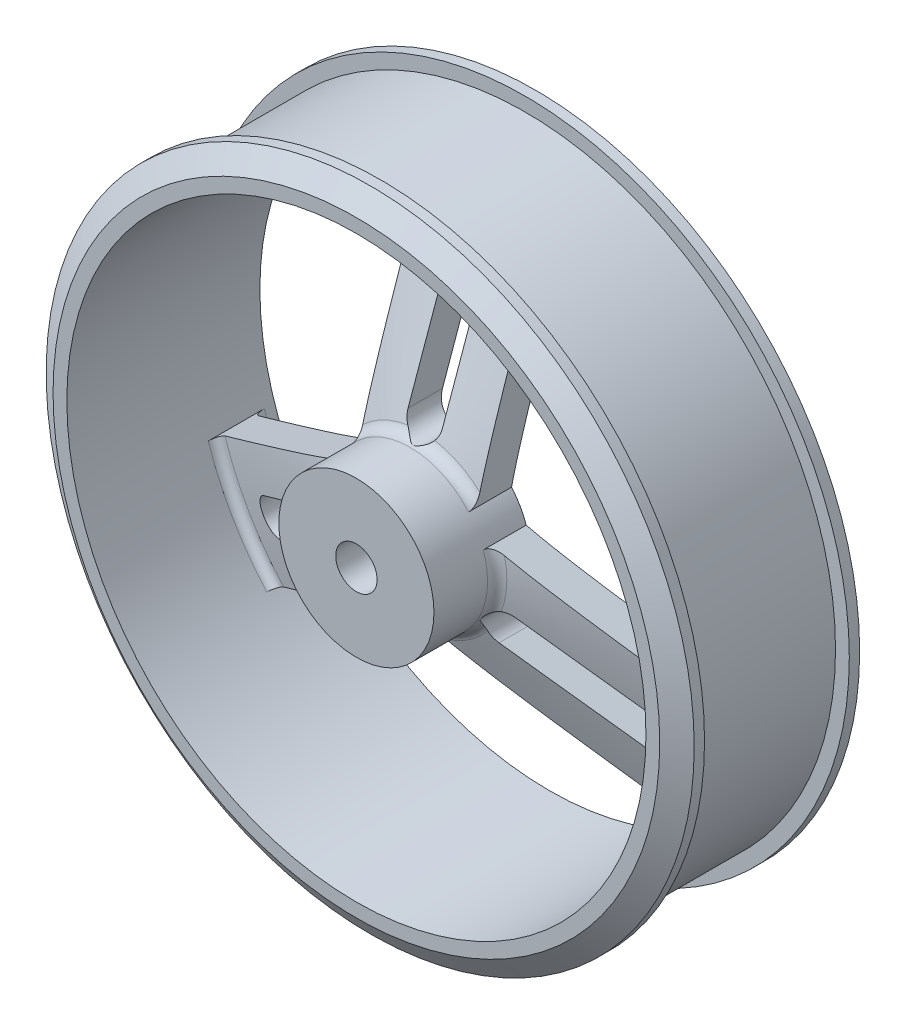
from build123d import *

# Parameters (mm, degrees)
CUT_EXTRUDE2_DEPTH      = 68.92643079096679
CUT_EXTRUDE2_DEPTH_BACK = 68.92643079096679


with BuildPart() as part:
    # Sketch1 → Revolve2 (revolve)
    with BuildSketch(Plane(origin=(0, 0, 0), x_dir=(1, 0, 0), z_dir=(0, 1, 0)), mode=Mode.PRIVATE) as revolve2_sk:
        with BuildLine():
            Line((-11.174557457948195, 1.388e-14), (-3.0000000000000044, 1.388e-14))
            Line((-3.0000000000000044, 1.388e-14), (-3.0000000000000044, -13.999999999999986))
            Line((-3.0000000000000044, -13.999999999999986), (-11.250000000000004, -13.999999999999986))
            Line((-11.250000000000004, -13.999999999999986), (-11.250000000000004, -6.226424863094397))
            ThreePointArc((-11.250000000000004, -6.226424863094397), (-11.567667832872525, -5.223744234512808), (-12.404763136484851, -4.586913999956628))
            Line((-12.404763136484851, -4.586913999956628), (-40.47025526751075, 5.452774242036372))
            ThreePointArc((-40.47025526751075, 5.452774242036372), (-41.51462498975523, 5.31087373951484), (-42.00000000000001, 4.375323116198959))
            Line((-42.00000000000001, 4.375323116198959), (-42, -13.999999999999986))
            Line((-42, -13.999999999999986), (-44, -13.999999999999986))
            Line((-44, -13.999999999999986), (-47, -12.000000000000004))
            Line((-47, -12.000000000000004), (-47, -10.500000000000002))
            Line((-47, -10.500000000000002), (-44.99999999999999, -10.5))
            Line((-44.99999999999999, -10.5), (-44.99999999999994, 10.49826373688146))
            Line((-44.99999999999994, 10.49826373688146), (-47, 10.49826373688146))
            Line((-47, 10.49826373688146), (-47, 11.998263736881459))
            Line((-47, 11.998263736881459), (-44.000000000000036, 14.000000000000016))
            Line((-44.000000000000036, 14.000000000000016), (-42, 14.000000000000014))
            Line((-42, 14.000000000000014), (-42, 12.500000000000009))
            ThreePointArc((-42, 12.500000000000009), (-41.611470899157645, 11.273654230168207), (-40.58764710594919, 10.494768070420855))
            Line((-40.58764710594919, 10.494768070420855), (-11.321034328401039, 0.02541065406215715))
            ThreePointArc((-11.321034328401039, 0.02541065406215715), (-11.248889777496164, 0.00639975332701209), (-11.174557457948195, 1.388e-14))
        make_face()
    revolve(revolve2_sk.sketch.rotate(Axis((0, 0, 31.339901161560984), (0, 0, -1)), 180), axis=Axis((0, 0, 31.339901161560984), (0, 0, -1)))

    # Sketch2 → Cut-Extrude2 (cut, two sides: drawn at the far end of the back side and taken through both)
    with BuildSketch(Plane.XY.offset(-CUT_EXTRUDE2_DEPTH_BACK)):
        with BuildLine():
            Line((-8.5, 41.13088863615762), (-8.499999999999996, 7.369701486491923))
            ThreePointArc((-8.499999999999996, 7.369701486491923), (-9.74278579257498, 5.62500000000003), (-10.63234870560994, 3.676365188921774))
            Line((-10.63234870560994, 3.676365188921774), (-39.87039443914103, -13.2042283859119))
            ThreePointArc((-39.87039443914103, -13.2042283859119), (-36.37306695894662, 20.99999999999966), (-8.5, 41.13088863615762))
        make_face()
        with BuildLine():
            Line((8.499999999999996, 41.13088863615762), (8.500000000000007, 7.369701486491911))
            ThreePointArc((8.500000000000007, 7.369701486491911), (9.742785792574985, 5.625000000000021), (10.632348705609944, 3.6763651889217672))
            Line((10.632348705609944, 3.6763651889217672), (39.87039443914113, -13.204228385911268))
            ThreePointArc((39.87039443914113, -13.204228385911268), (36.37306695894648, 20.99999999999992), (8.499999999999996, 41.13088863615762))
        make_face()
        with BuildLine():
            Line((2.5000000000000018, 33.807017959069995), (2.500000000000001, 13.807017959069992))
            ThreePointArc((2.500000000000001, 13.807017959069992), (-4.6e-16, 11.307017959069992), (-2.500000000000001, 13.807017959069992))
            Line((-2.500000000000001, 13.807017959069992), (-2.5000000000000018, 33.807017959069995))
            ThreePointArc((-2.5000000000000018, 33.807017959069995), (1.5e-16, 36.307017959069995), (2.5000000000000018, 33.807017959069995))
        make_face()
        with BuildLine():
            Line((31.370394439141066, -27.92666025024669), (2.1323487056099344, -11.046066675413691))
            ThreePointArc((2.1323487056099344, -11.046066675413691), (-4.31e-15, -11.250000000000055), (-2.132348705609942, -11.04606667541369))
            Line((-2.132348705609942, -11.04606667541369), (-31.370394439141023, -27.926660250247348))
            ThreePointArc((-31.370394439141023, -27.926660250247348), (2.5437e-13, -42.00000000000042), (31.370394439141066, -27.92666025024669))
        make_face()
        with BuildLine():
            Line((28.02773637875127, -19.068572488996224), (10.707228303062545, -9.068572488996143))
            ThreePointArc((10.707228303062545, -9.068572488996143), (9.792164793601465, -5.653508979535039), (13.207228303062564, -4.738445470073958))
            Line((13.207228303062564, -4.738445470073958), (30.527736378751293, -14.73844547007404))
            ThreePointArc((30.527736378751293, -14.73844547007404), (31.442799888212377, -18.153508979535143), (28.02773637875127, -19.068572488996224))
        make_face()
        with BuildLine():
            Line((-30.5277363787512, -14.738445470074707), (-13.207228303062434, -4.738445470074699))
            ThreePointArc((-13.207228303062434, -4.738445470074699), (-9.792164793602172, -5.653508979536135), (-10.707228303062667, -9.068572488995995))
            Line((-10.707228303062667, -9.068572488995995), (-28.027736378751197, -19.0685724889969))
            ThreePointArc((-28.027736378751197, -19.0685724889969), (-31.442799888212296, -18.153508979535804), (-30.5277363787512, -14.738445470074707))
        make_face()
    extrude(amount=CUT_EXTRUDE2_DEPTH + CUT_EXTRUDE2_DEPTH_BACK, mode=Mode.SUBTRACT)


solid = part.part
